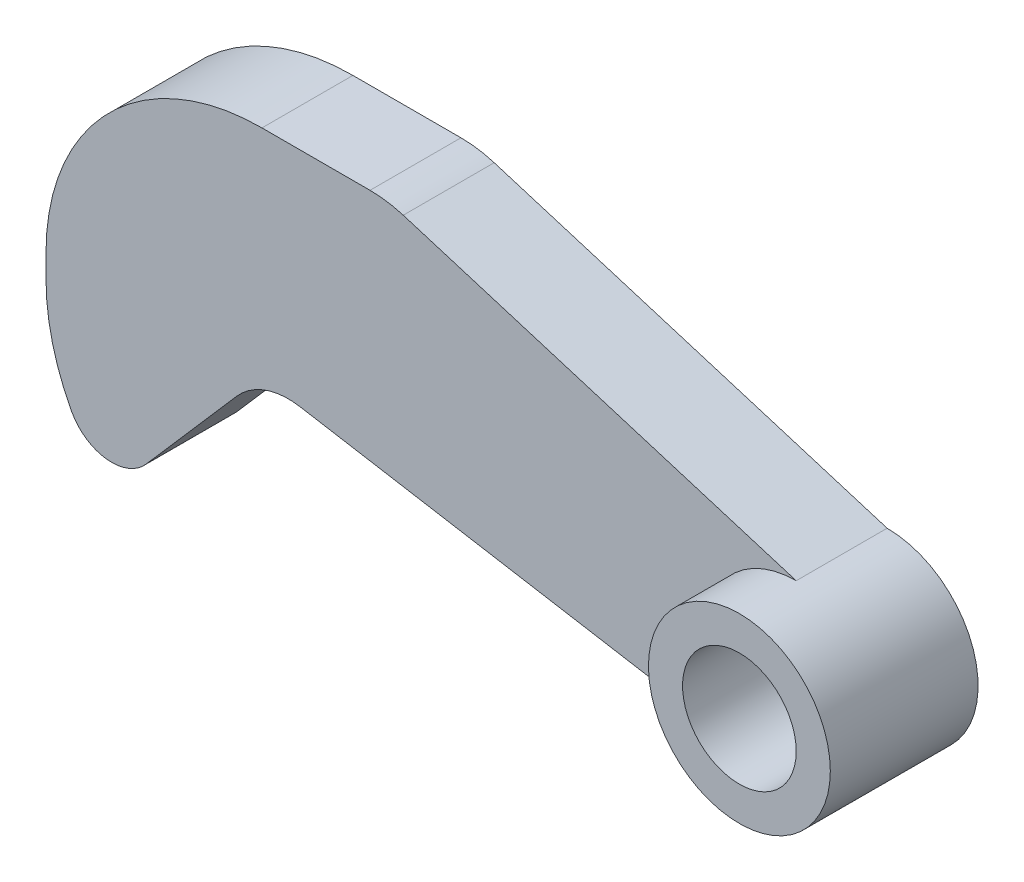
from build123d import *

# Parameters (mm, degrees)
ESBO_O1_R                = 4
RESSALTO_EXTRUS_O1_DEPTH = 4
ESBO_O3_R                = 4
RESSALTO_EXTRUS_O2_DEPTH = 2.5
ESBO_O5_R                = 2.5
CORTE_EXTRUS_O1_DEPTH    = 5.5


with BuildPart() as part:
    # Esboço1 → Ressalto-extrusão1 (new body)
    with BuildSketch(Plane.XY):
        with Locations((25, 0.5)):
            Circle(ESBO_O1_R)
        with BuildLine():
            ThreePointArc((0.394172842, -0.77044566), (1.648131789, 0.085177798), (3.16042427, 0.217374592))
            Line((3.16042427, 0.217374592), (23.676638803, -3.27474703))
            ThreePointArc((23.676638803, -3.27474703), (21.056715321, 1.171197392), (25, 4.5))
            Line((25, 4.5), (7.714247019, 9.781757855))
            ThreePointArc((7.714247019, 9.781757855), (6.991805383, 9.945138485), (6.253154341, 10))
            Line((6.253154341, 10), (1.5, 10))
            ThreePointArc((1.5, 10), (-5.217514421, 7.217514421), (-8, 0.5))
            Line((-8, 0.5), (-8, -0.5))
            ThreePointArc((-8, -0.5), (-7.713418989, -2.815795873), (-6.870966205, -4.991873194))
            ThreePointArc((-6.870966205, -4.991873194), (-5.331925608, -6.033714451), (-3.600088608, -5.359311184))
            Line((-3.600088608, -5.359311184), (0.394172842, -0.77044566))
        make_face()
    extrude(amount=RESSALTO_EXTRUS_O1_DEPTH)

    # Esboço3 → Ressalto-extrusão2 (add)
    with BuildSketch(Plane.XY.offset(4)):
        with Locations(Location((25, 0.5, 0), (0, 0, 250.680213843))):
            Circle(ESBO_O3_R)
    extrude(amount=RESSALTO_EXTRUS_O2_DEPTH)

    # Esboço5 → Corte-extrusão1 (cut)
    with BuildSketch(Plane.XY.offset(6.5)):
        with Locations((25, 0.5)):
            Circle(ESBO_O5_R)
    extrude(amount=-CORTE_EXTRUS_O1_DEPTH, mode=Mode.SUBTRACT)


solid = part.part
